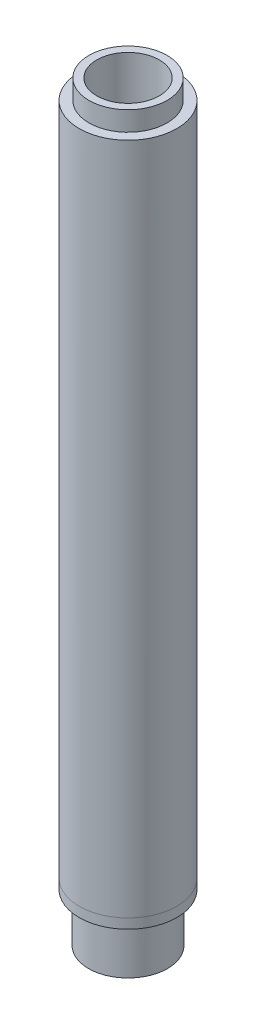
from build123d import *

# Parameters (mm, degrees)
SKETCH1_R           = 12.7
BOSS_EXTRUDE1_DEPTH = 177.8
SKETCH4_R           = 10.16
BOSS_EXTRUDE2_DEPTH = 5.08
SKETCH5_R           = 8.128
CUT_EXTRUDE1_DEPTH  = 184.759828036
SKETCH6_R           = 10.287
SKETCH6_R_2         = 8.128
BOSS_EXTRUDE3_DEPTH = 12.7


with BuildPart() as part:
    # Sketch1 → Boss-Extrude1 (new body)
    with BuildSketch(Plane(origin=(0, 0, 0), x_dir=(1, 0, 0), z_dir=(0, 1, 0))):
        with Locations(Location((0, 0, 0), (0, 0, 270))):
            Circle(SKETCH1_R)
    extrude(amount=BOSS_EXTRUDE1_DEPTH)

    # Sketch4 → Boss-Extrude2 (add)
    with BuildSketch(Plane(origin=(0, 177.8, 0), x_dir=(1, 0, 0), z_dir=(0, 1, 0))):
        with Locations(Location((0, 0, 0), (0, 0, 270))):
            Circle(SKETCH4_R)
    extrude(amount=BOSS_EXTRUDE2_DEPTH)

    # Sketch5 → Cut-Extrude1 (cut, through all)
    with BuildSketch(Plane(origin=(0, 182.88, 0), x_dir=(1, 0, 0), z_dir=(0, 1, 0))):
        with Locations(Location((0, 0, 0), (0, 0, 270))):
            Circle(SKETCH5_R)
    extrude(amount=-CUT_EXTRUDE1_DEPTH, mode=Mode.SUBTRACT)

    # Sketch6 → Boss-Extrude3 (add)
    with BuildSketch(Plane.XZ):
        with Locations(Location((0, 0, 0), (0, 0, 90))):
            Circle(SKETCH6_R)
        with Locations(Location((0, 0, 0), (0, 0, 90))):
            Circle(SKETCH6_R_2, mode=Mode.SUBTRACT)
    extrude(amount=BOSS_EXTRUDE3_DEPTH)


with BuildPart() as body_2:
    # Split1: the piece on the far side of the plane
    add(part.part)
    split(bisect_by=Plane(origin=(0, 2.54, 0), x_dir=(0, 0, -1), z_dir=(0, -1, 0)), keep=Keep.BOTTOM)


with BuildPart() as part_1:
    add(part.part)

    # Split1
    split(bisect_by=Plane(origin=(0, 2.54, 0), x_dir=(0, 0, -1), z_dir=(0, -1, 0)), keep=Keep.TOP)


solid = Compound([body_2.part, part_1.part])
